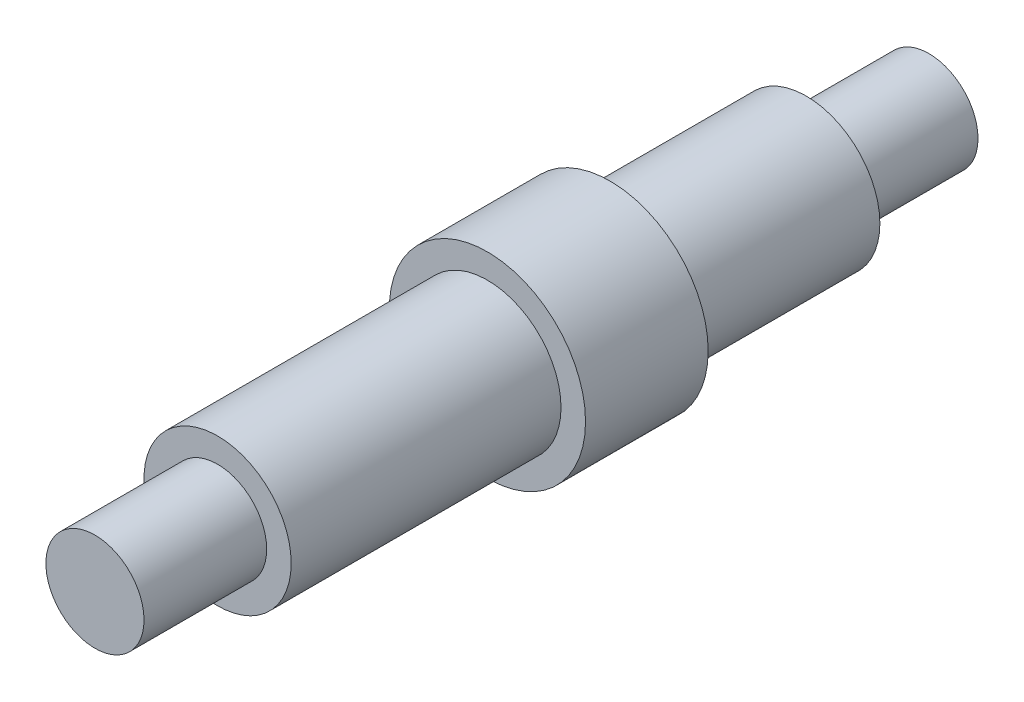
from build123d import *

# Parameters (mm, degrees)
SKETCH1_R           = 2
BOSS_EXTRUDE1_DEPTH = 34
BOSS_EXTRUDE2_START = 5
SKETCH1_3_R         = 3
BOSS_EXTRUDE2_DEPTH = 24
BOSS_EXTRUDE3_START = 13
SKETCH1_4_R         = 4
BOSS_EXTRUDE3_DEPTH = 5


with BuildPart() as part:
    # Sketch1 → Boss-Extrude1 (new body)
    with BuildSketch(Plane.XY):
        Circle(SKETCH1_R)
    extrude(amount=BOSS_EXTRUDE1_DEPTH)

    # Sketch1<3> → Boss-Extrude2 (add)
    with BuildSketch(Plane.XY.offset(BOSS_EXTRUDE2_START)):
        Circle(SKETCH1_3_R)
    extrude(amount=BOSS_EXTRUDE2_DEPTH)

    # Sketch1<4> → Boss-Extrude3 (add)
    with BuildSketch(Plane.XY.offset(BOSS_EXTRUDE3_START)):
        Circle(SKETCH1_4_R)
    extrude(amount=BOSS_EXTRUDE3_DEPTH)


solid = part.part
